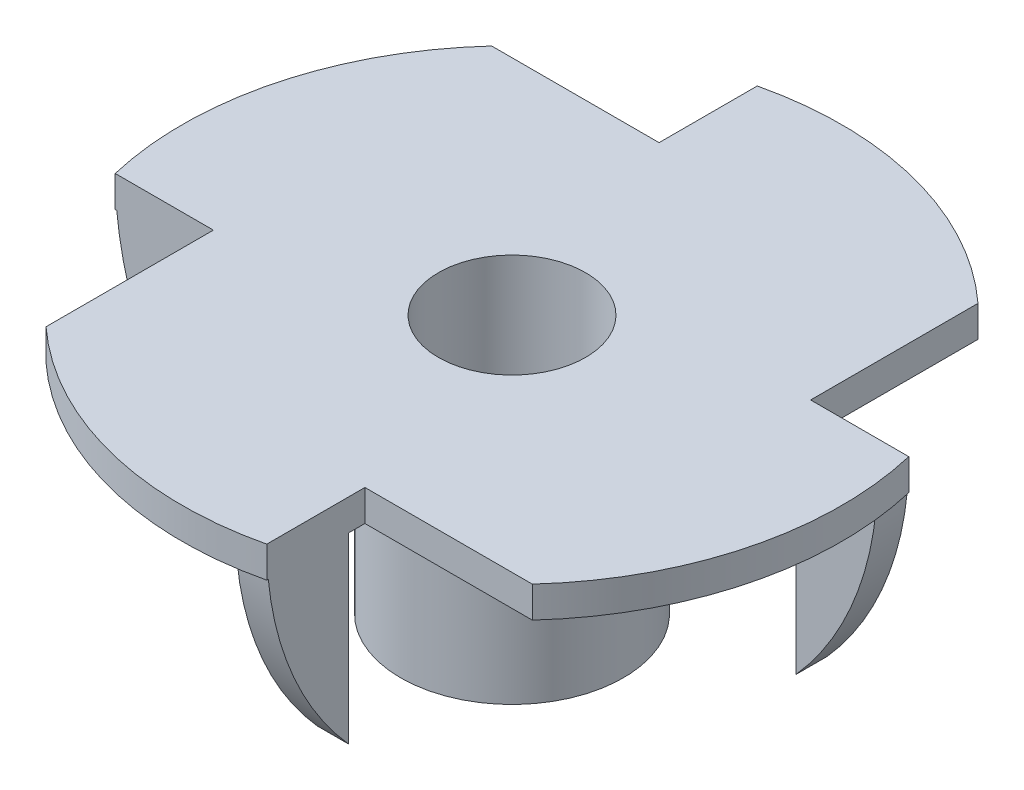
from build123d import *

# Parameters (mm, degrees)
TROU_TARAUD_M41_D            = 3.3
TROU_TARAUD_M41_DEPTH        = 11.5
TROU_TARAUD_M41_TIP          = 0.991420021
ESQUISSE4_W                  = 5.010008652
ESQUISSE4_H                  = 3.395361839
ESQUISSE4_W_2                = 3.395361839
ESQUISSE4_H_2                = 5.010008652
ENL_V_MAT_EXTRU_1_DEPTH      = 10
BOSS_EXTRU_1_DEPTH           = 0.7
R_P_TITION_CIRCULAIRE1_COUNT = 4


with BuildPart() as part:
    # Esquisse1 → Révolution1 (revolve)
    with BuildSketch(Plane.XY, mode=Mode.PRIVATE) as r_volution1_sk:
        Polygon((0, 0), (2.5, 0), (2.5, 5.1), (7.4, 5.1), (7.4, 5.8), (0, 5.8), align=None)
    revolve(r_volution1_sk.sketch.rotate(Axis((0, 0, 0), (0, 1, 0)), 90), axis=Axis((0, 0, 0), (0, 1, 0)))

    # Trou taraudé M41
    with Locations(Plane(origin=(0, 5.8, 0), x_dir=(1, 0, 0), z_dir=(0, 1, 0))):
        with Locations((0, 0)):
            Hole(TROU_TARAUD_M41_D / 2, depth=TROU_TARAUD_M41_DEPTH)
            with Locations((0, 0, -(TROU_TARAUD_M41_DEPTH + TROU_TARAUD_M41_TIP / 2))):  # 118° drill point
                Cone(0, TROU_TARAUD_M41_D / 2, TROU_TARAUD_M41_TIP, mode=Mode.SUBTRACT)

    # Esquisse4 → Enlèv. mat.-Extru.1 (cut)
    with BuildSketch(Plane(origin=(0, 5.8, 0), x_dir=(1, 0, 0), z_dir=(0, 1, 0))):
        with Locations((4.205004326, -6.69768092)):
            Rectangle(ESQUISSE4_W, ESQUISSE4_H)
        with Locations((6.69768092, 4.205004326)):
            Rectangle(ESQUISSE4_W_2, ESQUISSE4_H_2)
        with Locations((-6.69768092, -4.205004326)):
            Rectangle(ESQUISSE4_W_2, ESQUISSE4_H_2)
        with Locations((-4.205004326, 6.69768092)):
            Rectangle(ESQUISSE4_W, ESQUISSE4_H)
    extrude(amount=-ENL_V_MAT_EXTRU_1_DEPTH, mode=Mode.SUBTRACT)

    # Esquisse5 → Boss.-Extru.1 (add)
    with BuildSketch(Plane(origin=(0, 0, -1.7), x_dir=(-1, 0, 0), z_dir=(0, 0, -1))):
        with BuildLine():
            Line((-5.369357503, 1), (-5.369357503, 5.8))
            Line((-5.369357503, 5.8), (-7.202083032, 5.8))
            ThreePointArc((-7.202083032, 5.8), (-6.728319202, 3.23100784), (-5.369357503, 1))
        make_face()
    boss_extru_1 = extrude(amount=-BOSS_EXTRU_1_DEPTH)

    # Répétition circulaire1: Boss.-Extru.1 ×4 about axis
    r_p_tition_circulaire1_axis = Axis((0, 0, 0), (0, 1, 0))
    for i in range(1, R_P_TITION_CIRCULAIRE1_COUNT):
        add(boss_extru_1.rotate(r_p_tition_circulaire1_axis, i * 360 / R_P_TITION_CIRCULAIRE1_COUNT))


solid = part.part
